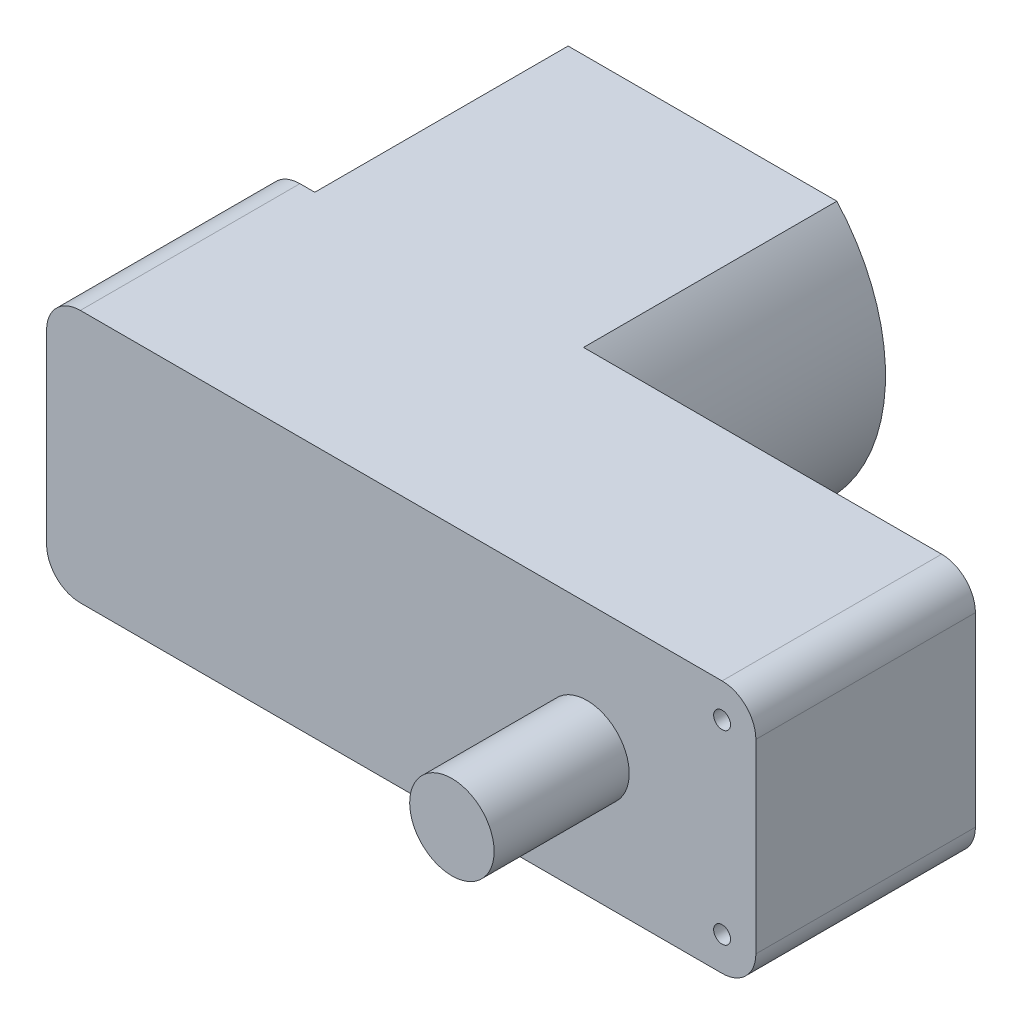
from build123d import *

# Parameters (mm, degrees)
BOSS_EXTRUDE1_DEPTH = 15
SKETCH2_W           = 42
SKETCH2_H           = 15
BOSS_EXTRUDE2_DEPTH = 13
FILLET1_R           = 2
SKETCH3_R           = 2.5
BOSS_EXTRUDE3_DEPTH = 8
SKETCH4_R           = 0.5
CUT_EXTRUDE1_DEPTH  = 43.558628129


with BuildPart() as part:
    # Sketch1 → Boss-Extrude1 (new body)
    with BuildSketch(Plane.XY):
        with BuildLine():
            ThreePointArc((7.957391107, 7.5), (10.83933845, 0), (7.957391107, -7.5))
            Line((7.957391107, -7.5), (-7.957391107, -7.5))
            ThreePointArc((-7.957391107, -7.5), (-10.83933845, 0), (-7.957391107, 7.5))
            Line((-7.957391107, 7.5), (7.957391107, 7.5))
        make_face()
        with BuildLine():
            Line((-7.5, 6.5), (7.5, 6.5))
            ThreePointArc((7.5, 6.5), (9.83933845, 0), (7.5, -6.5))
            Line((7.5, -6.5), (-7.5, -6.5))
            ThreePointArc((-7.5, -6.5), (-9.83933845, 0), (-7.5, 6.5))
        make_face(mode=Mode.SUBTRACT)
    extrude(amount=BOSS_EXTRUDE1_DEPTH)

    # Sketch2 → Boss-Extrude2 (add)
    with BuildSketch(Plane.XY.offset(15)):
        with Locations((10.16066155, 0)):
            Rectangle(SKETCH2_W, SKETCH2_H)
    extrude(amount=BOSS_EXTRUDE2_DEPTH)

    # Fillet1
    fillet1_edges = [part.edges().sort_by_distance(p)[0] for p in [
        (31.16066155, 7.5, 21.5),
        (-10.83933845, 7.5, 21.5),
        (-10.83933845, -7.5, 21.5),
        (31.16066155, -7.5, 21.5),
    ]]
    fillet(fillet1_edges, radius=FILLET1_R)

    # Sketch3 → Boss-Extrude3 (add)
    with BuildSketch(Plane.XY.offset(28)):
        with Locations(Location((21.16066155, 0, 0), (0, 0, 180))):
            Circle(SKETCH3_R)
    extrude(amount=BOSS_EXTRUDE3_DEPTH)

    # Sketch4 → Cut-Extrude1 (cut, through all)
    with BuildSketch(Plane.XY.offset(28)):
        with Locations((29.16066155, 5.5)):
            Circle(SKETCH4_R)
    cut_extrude1 = extrude(amount=-CUT_EXTRUDE1_DEPTH, mode=Mode.SUBTRACT)

    # Mirror1: Cut-Extrude1 across plane
    add(cut_extrude1.mirror(Plane.ZX), mode=Mode.SUBTRACT)


solid = part.part
